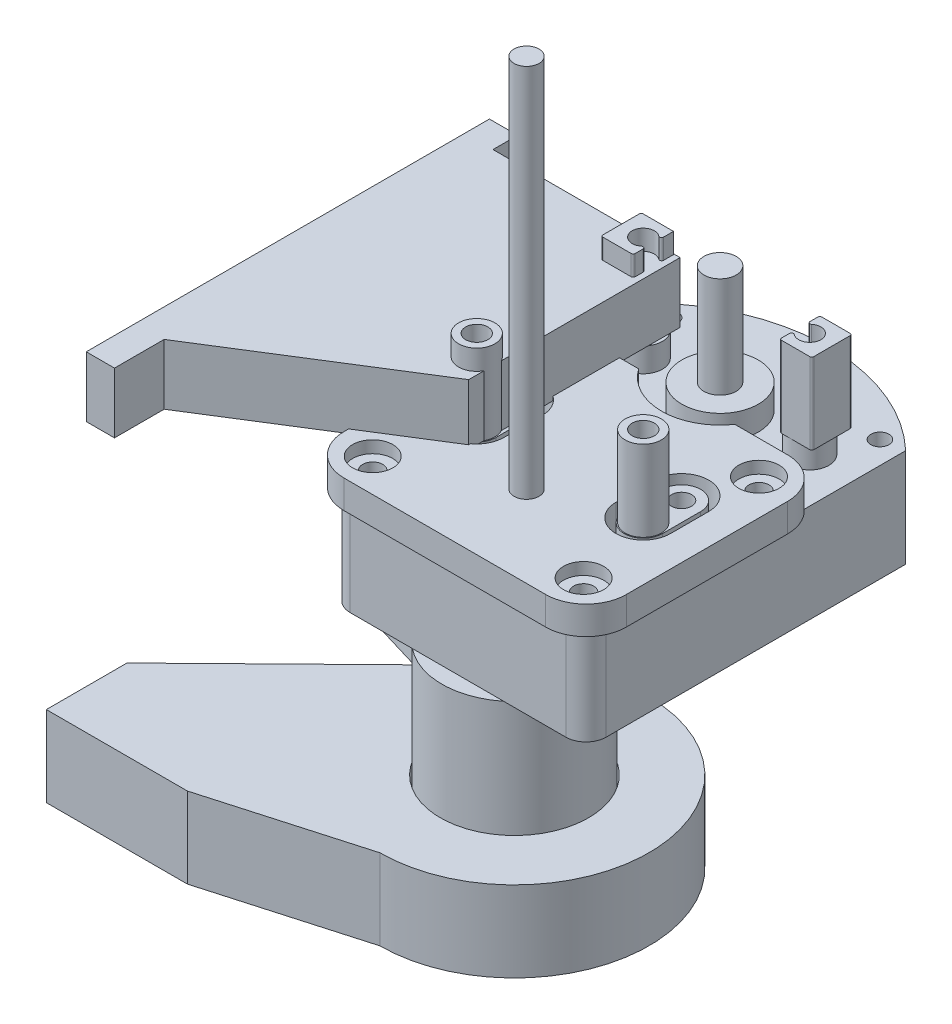
from build123d import *

# Parameters (mm, degrees)
SKETCH1_W              = 63.5
SKETCH1_H              = 92
SKETCH1_R              = 2.25
BOSS_EXTRUDE1_DEPTH    = 24.4
SKETCH2_R              = 4.75
SKETCH2_R_2            = 2.5
SKETCH2_R_3            = 9.5
SKETCH2_R_4            = 4
BOSS_EXTRUDE2_DEPTH    = 6
SKETCH3_R              = 4
BOSS_EXTRUDE3_DEPTH    = 31
FILLET1_R              = 5
SKETCH5_R              = 3.1
BOSS_EXTRUDE4_DEPTH    = 100
SKETCH6_R              = 18
BOSS_EXTRUDE5_DEPTH    = 57
CUT_EXTRUDE1_DEPTH     = 24.4
BOSS_EXTRUDE6_DEPTH    = 15
SKETCH9_R              = 18.4
BOSS_EXTRUDE7_DEPTH    = 20
SKETCH11_R             = 4.85
SKETCH11_R_2           = 2.25
BOSS_EXTRUDE8_DEPTH    = 1
SKETCH10_R             = 8.5
SKETCH10_R_2           = 5.85
BOSS_EXTRUDE9_DEPTH    = 7
SKETCH12_R             = 8.5
SKETCH12_R_2           = 3.1
BOSS_EXTRUDE10_DEPTH   = 1
FILLET2_R              = 10
SKETCH13_R             = 5.85
SKETCH13_R_2           = 2.5
BOSS_EXTRUDE11_DEPTH   = 6
SKETCH14_R             = 4.5
SKETCH14_R_2           = 2.75
BOSS_EXTRUDE12_DEPTH   = 20
BOSS_EXTRUDE12_2_DEPTH = 20
BOSS_EXTRUDE13_DEPTH   = 20
BOSS_EXTRUDE13_2_DEPTH = 20
FILLET3_R              = 0.5
FILLET4_R              = 0.5
SKETCH16_R             = 5
CUT_EXTRUDE2_DEPTH     = 3
SKETCH17_R             = 2.25
BOSS_EXTRUDE14_DEPTH   = 8
BOSS_EXTRUDE15_DEPTH   = 15
SKETCH19_R             = 2.75
CUT_EXTRUDE3_DEPTH     = 6
SKETCH20_R             = 2.75
CUT_EXTRUDE4_DEPTH     = 6
FILLET5_R              = 3
FILLET6_R              = 3


with BuildPart() as part:
    # Sketch1 → Boss-Extrude1 (new body)
    with BuildSketch(Plane(origin=(0, 0, 0), x_dir=(1, 0, 0), z_dir=(0, 1, 0))):
        Rectangle(SKETCH1_W, SKETCH1_H)
        with Locations(Location((26.15, 2.5, 0), (0, 0, 270))):
            Circle(SKETCH1_R, mode=Mode.SUBTRACT)
        with Locations(Location((-26.15, -41, 0), (0, 0, 270))):
            Circle(SKETCH1_R, mode=Mode.SUBTRACT)
        with Locations(Location((-26.15, 2.5, 0), (0, 0, 270))):
            Circle(SKETCH1_R, mode=Mode.SUBTRACT)
        with Locations(Location((-26.15, 32.5, 0), (0, 0, 270))):
            Circle(SKETCH1_R, mode=Mode.SUBTRACT)
        with Locations(Location((26.15, 32.5, 0), (0, 0, 270))):
            Circle(SKETCH1_R, mode=Mode.SUBTRACT)
        with Locations(Location((26.15, -41, 0), (0, 0, 270))):
            Circle(SKETCH1_R, mode=Mode.SUBTRACT)
    extrude(amount=BOSS_EXTRUDE1_DEPTH)

    # Sketch2 → Boss-Extrude2 (add)
    # profile 1 of 5: a face of its own
    with BuildSketch(Plane(origin=(0, 24.4, 0), x_dir=(1, 0, 0), z_dir=(0, 1, 0))):
        with Locations(Location((-20.65, 20.6, 0), (0, 0, 270))):
            Circle(SKETCH2_R)
        with Locations(Location((-20.65, 20.6, 0), (0, 0, 270))):
            Circle(SKETCH2_R_2, mode=Mode.SUBTRACT)
    # profile 2 of 5: a face of its own
    with BuildSketch(Plane(origin=(0, 24.4, 0), x_dir=(1, 0, 0), z_dir=(0, 1, 0))):
        with Locations(Location((0, 19, 0), (0, 0, 270))):
            Circle(SKETCH2_R_3)
        with Locations(Location((0, 19, 0), (0, 0, 270))):
            Circle(SKETCH2_R_4, mode=Mode.SUBTRACT)
    # profile 3 of 5: a face of its own
    with BuildSketch(Plane(origin=(0, 24.4, 0), x_dir=(1, 0, 0), z_dir=(0, 1, 0))):
        with Locations(Location((20.65, 20.6, 0), (0, 0, 90))):
            Circle(SKETCH2_R)
        with Locations(Location((20.65, 20.6, 0), (0, 0, 90))):
            Circle(SKETCH2_R_2, mode=Mode.SUBTRACT)
    # profile 4 of 5: a face of its own
    with BuildSketch(Plane(origin=(0, 24.4, 0), x_dir=(1, 0, 0), z_dir=(0, 1, 0))):
        with BuildLine():
            Line((-15.9, -11.2), (-15.9, -20.7))
            ThreePointArc((-15.9, -20.7), (-20.65, -25.45), (-25.4, -20.7))
            Line((-25.4, -20.7), (-25.4, -11.2))
            ThreePointArc((-25.4, -11.2), (-20.65, -6.45), (-15.9, -11.2))
        make_face()
        with Locations(Location((-20.65, -11.2, 0), (0, 0, 270))):
            Circle(SKETCH2_R_2, mode=Mode.SUBTRACT)
        with Locations(Location((-20.65, -20.7, 0), (0, 0, 270))):
            Circle(SKETCH2_R_2, mode=Mode.SUBTRACT)
    # profile 5 of 5: a face of its own
    with BuildSketch(Plane(origin=(0, 24.4, 0), x_dir=(1, 0, 0), z_dir=(0, 1, 0))):
        with BuildLine():
            Line((15.9, -11.2), (15.9, -20.7))
            ThreePointArc((15.9, -20.7), (20.65, -25.45), (25.4, -20.7))
            Line((25.4, -20.7), (25.4, -11.2))
            ThreePointArc((25.4, -11.2), (20.65, -6.45), (15.9, -11.2))
        make_face()
        with Locations(Location((20.65, -20.7, 0), (0, 0, 90))):
            Circle(SKETCH2_R_2, mode=Mode.SUBTRACT)
        with Locations(Location((20.65, -11.2, 0), (0, 0, 90))):
            Circle(SKETCH2_R_2, mode=Mode.SUBTRACT)
    extrude(amount=BOSS_EXTRUDE2_DEPTH)

    # Sketch3 → Boss-Extrude3 (add)
    with BuildSketch(Plane(origin=(0, 24.4, 0), x_dir=(1, 0, 0), z_dir=(0, 1, 0))):
        with Locations(Location((0, 19, 0), (0, 0, 270))):
            Circle(SKETCH3_R)
    extrude(amount=BOSS_EXTRUDE3_DEPTH)

    # Fillet1
    fillet1_edges = [part.edges().sort_by_distance(p)[0] for p in [
        (31.75, 12.2, 46),
        (-31.75, 12.2, 46),
    ]]
    fillet(fillet1_edges, radius=FILLET1_R)

    # Sketch6 → Boss-Extrude5 (add)
    with BuildSketch(Plane.XZ):
        with Locations(Location((0, 32, 0), (0, 0, 128.942441269))):
            Circle(SKETCH6_R)
    extrude(amount=BOSS_EXTRUDE5_DEPTH)

    # Sketch7 → Cut-Extrude1 (cut)
    with BuildSketch(Plane(origin=(0, 24.4, 0), x_dir=(1, 0, 0), z_dir=(0, 1, 0))):
        with BuildLine():
            ThreePointArc((-31.75, 33.285695126), (-17.100555901, 42.70329013), (0, 46))
            Line((0, 46), (-31.75, 46))
            Line((-31.75, 46), (-31.75, 33.285695126))
        make_face()
        with BuildLine():
            ThreePointArc((0, 46), (17.100555901, 42.70329013), (31.75, 33.285695126))
            Line((31.75, 33.285695126), (31.75, 46))
            Line((31.75, 46), (0, 46))
        make_face()
    extrude(amount=-CUT_EXTRUDE1_DEPTH, mode=Mode.SUBTRACT)

    # Sketch11 → Boss-Extrude8 (add)
    # profile 1 of 4: a face of its own
    with BuildSketch(Plane(origin=(0, 24.4, 0), x_dir=(1, 0, 0), z_dir=(0, 1, 0))):
        with Locations(Location((-26.15, 2.5, 0), (0, 0, 270))):
            Circle(SKETCH11_R)
        with Locations(Location((-26.15, 2.5, 0), (0, 0, 270))):
            Circle(SKETCH11_R_2, mode=Mode.SUBTRACT)
    # profile 2 of 4: a face of its own
    with BuildSketch(Plane(origin=(0, 24.4, 0), x_dir=(1, 0, 0), z_dir=(0, 1, 0))):
        with Locations(Location((26.15, 2.5, 0), (0, 0, 270))):
            Circle(SKETCH11_R)
        with Locations(Location((26.15, 2.5, 0), (0, 0, 270))):
            Circle(SKETCH11_R_2, mode=Mode.SUBTRACT)
    # profile 3 of 4: a face of its own
    with BuildSketch(Plane(origin=(0, 24.4, 0), x_dir=(1, 0, 0), z_dir=(0, 1, 0))):
        with Locations(Location((-26.15, -41, 0), (0, 0, 270))):
            Circle(SKETCH11_R)
        with Locations(Location((-26.15, -41, 0), (0, 0, 270))):
            Circle(SKETCH11_R_2, mode=Mode.SUBTRACT)
    # profile 4 of 4: a face of its own
    with BuildSketch(Plane(origin=(0, 24.4, 0), x_dir=(1, 0, 0), z_dir=(0, 1, 0))):
        with Locations(Location((26.15, -41, 0), (0, 0, 270))):
            Circle(SKETCH11_R)
        with Locations(Location((26.15, -41, 0), (0, 0, 270))):
            Circle(SKETCH11_R_2, mode=Mode.SUBTRACT)
    extrude(amount=BOSS_EXTRUDE8_DEPTH)


with BuildPart() as body_2:
    # Sketch5 → Boss-Extrude4 (new body)
    with BuildSketch(Plane(origin=(0, 24.4, 0), x_dir=(1, 0, 0), z_dir=(0, 1, 0))):
        with Locations(Location((0, -29, 0), (0, 0, 270))):
            Circle(SKETCH5_R)
    extrude(amount=BOSS_EXTRUDE4_DEPTH)


with BuildPart() as body_3:
    # Sketch8 → Boss-Extrude6 (new body)
    with BuildSketch(Plane(origin=(0, 30.4, 0), x_dir=(1, 0, 0), z_dir=(0, 1, 0))):
        Polygon((-16.699127066, 25.789474079), (-16.699127066, -26.645742509), (-63.11, -55.775738239), (-63.11, -68.098641121), (-70.11, -68.098641121), (-70.11, 31.901358879), (-63.11, 31.901358879), (-63.11, 25.789474079), align=None)
    extrude(amount=BOSS_EXTRUDE6_DEPTH)


with BuildPart() as body_4:
    # Sketch9 → Boss-Extrude7 (new body)
    with BuildSketch(Plane(origin=(0, -28.5, 0), x_dir=(-1, 0, 0), z_dir=(0, -1, 0))):
        with BuildLine():
            Line((25.14916505, -10.058638045), (72.11, -56))
            Line((72.11, -56), (72.11, -76))
            Line((72.11, -76), (37.11, -76))
            Line((37.11, -76), (0, -65.4))
            ThreePointArc((0, -65.4), (-33.4, -32), (0, 1.4))
            Line((0, 1.4), (42.281592381, 24))
            Line((42.281592381, 24), (72.11, 24))
            Line((72.11, 24), (72.11, 4))
            Line((72.11, 4), (25.14916505, -10.058638045))
        make_face()
        with Locations(Location((0, -32, 0), (0, 0, 90))):
            Circle(SKETCH9_R, mode=Mode.SUBTRACT)
    extrude(amount=BOSS_EXTRUDE7_DEPTH)


with BuildPart() as body_5:
    # Sketch10 → Boss-Extrude9 (new body)
    with BuildSketch(Plane(origin=(0, 24.4, 0), x_dir=(1, 0, 0), z_dir=(0, 1, 0))):
        with BuildLine():
            Line((-11.924240018, 10.75), (-35, 10.75))
            Line((-35, 10.75), (-35, -49.25))
            Line((-35, -49.25), (35, -49.25))
            Line((35, -49.25), (35, 10.75))
            Line((35, 10.75), (11.924240018, 10.75))
            ThreePointArc((11.924240018, 10.75), (0, 4.5), (-11.924240018, 10.75))
        make_face()
        with Locations(Location((0, -29, 0), (0, 0, 270))):
            Circle(SKETCH10_R, mode=Mode.SUBTRACT)
        with Locations(Location((-26.15, 2.5, 0), (0, 0, 270))):
            Circle(SKETCH10_R_2, mode=Mode.SUBTRACT)
        with Locations(Location((26.15, 2.5, 0), (0, 0, 270))):
            Circle(SKETCH10_R_2, mode=Mode.SUBTRACT)
        with Locations(Location((26.15, -41, 0), (0, 0, 270))):
            Circle(SKETCH10_R_2, mode=Mode.SUBTRACT)
        with Locations(Location((-26.15, -41, 0), (0, 0, 270))):
            Circle(SKETCH10_R_2, mode=Mode.SUBTRACT)
        with BuildLine():
            Line((13.9, -11.2), (13.9, -20.7))
            ThreePointArc((13.9, -20.7), (20.65, -27.45), (27.4, -20.7))
            Line((27.4, -20.7), (27.4, -11.2))
            ThreePointArc((27.4, -11.2), (20.65, -4.45), (13.9, -11.2))
        make_face(mode=Mode.SUBTRACT)
        with BuildLine():
            Line((-27.4, -11.2), (-27.4, -20.7))
            ThreePointArc((-27.4, -20.7), (-20.65, -27.45), (-13.9, -20.7))
            Line((-13.9, -20.7), (-13.9, -11.2))
            ThreePointArc((-13.9, -11.2), (-20.65, -4.45), (-27.4, -11.2))
        make_face(mode=Mode.SUBTRACT)
    extrude(amount=BOSS_EXTRUDE9_DEPTH)

    # Sketch12 → Boss-Extrude10 (add)
    with BuildSketch(Plane(origin=(0, 31.4, 0), x_dir=(1, 0, 0), z_dir=(0, 1, 0))):
        with Locations(Location((0, -29, 0), (0, 0, 270))):
            Circle(SKETCH12_R)
        with Locations(Location((0, -29, 0), (0, 0, 270))):
            Circle(SKETCH12_R_2, mode=Mode.SUBTRACT)
    extrude(amount=-BOSS_EXTRUDE10_DEPTH)

    # Fillet2
    fillet2_edges = [body_5.edges().sort_by_distance(p)[0] for p in [
        (35, 27.9, -10.75),
        (35, 27.9, 49.25),
        (-35, 27.9, 49.25),
        (-35, 27.9, -10.75),
    ]]
    fillet(fillet2_edges, radius=FILLET2_R)

    # Sketch13 → Boss-Extrude11 (add)
    # profile 1 of 4: a face of its own
    with BuildSketch(Plane(origin=(0, 31.4, 0), x_dir=(1, 0, 0), z_dir=(0, 1, 0))):
        with Locations(Location((-26.15, 2.5, 0), (0, 0, 270))):
            Circle(SKETCH13_R)
        with Locations(Location((-26.15, 2.5, 0), (0, 0, 270))):
            Circle(SKETCH13_R_2, mode=Mode.SUBTRACT)
    # profile 2 of 4: a face of its own
    with BuildSketch(Plane(origin=(0, 31.4, 0), x_dir=(1, 0, 0), z_dir=(0, 1, 0))):
        with Locations(Location((26.15, 2.5, 0), (0, 0, 270))):
            Circle(SKETCH13_R)
        with Locations(Location((26.15, 2.5, 0), (0, 0, 270))):
            Circle(SKETCH13_R_2, mode=Mode.SUBTRACT)
    # profile 3 of 4: a face of its own
    with BuildSketch(Plane(origin=(0, 31.4, 0), x_dir=(1, 0, 0), z_dir=(0, 1, 0))):
        with Locations(Location((-26.15, -41, 0), (0, 0, 270))):
            Circle(SKETCH13_R)
        with Locations(Location((-26.15, -41, 0), (0, 0, 270))):
            Circle(SKETCH13_R_2, mode=Mode.SUBTRACT)
    # profile 4 of 4: a face of its own
    with BuildSketch(Plane(origin=(0, 31.4, 0), x_dir=(1, 0, 0), z_dir=(0, 1, 0))):
        with Locations(Location((26.15, -41, 0), (0, 0, 270))):
            Circle(SKETCH13_R)
        with Locations(Location((26.15, -41, 0), (0, 0, 270))):
            Circle(SKETCH13_R_2, mode=Mode.SUBTRACT)
    extrude(amount=-BOSS_EXTRUDE11_DEPTH)

    # Sketch16 → Cut-Extrude2 (cut)
    with BuildSketch(Plane(origin=(0, 31.4, 0), x_dir=(1, 0, 0), z_dir=(0, 1, 0))):
        with Locations(Location((-26.15, 2.5, 0), (0, 0, 270))):
            Circle(SKETCH16_R)
        with Locations(Location((26.15, 2.5, 0), (0, 0, 270))):
            Circle(SKETCH16_R)
        with Locations(Location((26.15, -41, 0), (0, 0, 270))):
            Circle(SKETCH16_R)
        with Locations(Location((-26.15, -41, 0), (0, 0, 270))):
            Circle(SKETCH16_R)
    extrude(amount=-CUT_EXTRUDE2_DEPTH, mode=Mode.SUBTRACT)


with BuildPart() as body_6:
    # Sketch14 → Boss-Extrude12 (new body)
    with BuildSketch(Plane(origin=(0, 30.4, 0), x_dir=(1, 0, 0), z_dir=(0, 1, 0))):
        with Locations(Location((20.65, -20.7, 0), (0, 0, 270))):
            Circle(SKETCH14_R)
        with Locations(Location((20.65, -20.7, 0), (0, 0, 270))):
            Circle(SKETCH14_R_2, mode=Mode.SUBTRACT)
    extrude(amount=BOSS_EXTRUDE12_DEPTH)


with BuildPart() as body_7:
    # Sketch14 → Boss-Extrude12 2 (new body)
    with BuildSketch(Plane(origin=(0, 30.4, 0), x_dir=(1, 0, 0), z_dir=(0, 1, 0))):
        with Locations(Location((-20.65, -20.7, 0), (0, 0, 270))):
            Circle(SKETCH14_R)
        with Locations(Location((-20.65, -20.7, 0), (0, 0, 270))):
            Circle(SKETCH14_R_2, mode=Mode.SUBTRACT)
    extrude(amount=BOSS_EXTRUDE12_2_DEPTH)


with BuildPart() as body_8:
    # Sketch15 → Boss-Extrude13 (new body)
    with BuildSketch(Plane(origin=(0, 30.4, 0), x_dir=(1, 0, 0), z_dir=(0, 1, 0))):
        with BuildLine():
            Line((-18.15, 24.638873605), (-18.15, 21.745643924))
            ThreePointArc((-18.15, 21.745643924), (-23.4, 20.6), (-18.15, 19.454356076))
            Line((-18.15, 19.454356076), (-18.15, 16.561126395))
            Line((-18.15, 16.561126395), (-18.15, 15.6))
            Line((-18.15, 15.6), (-26.15, 15.6))
            Line((-26.15, 15.6), (-26.15, 25.6))
            Line((-26.15, 25.6), (-18.15, 25.6))
            Line((-18.15, 25.6), (-18.15, 24.638873605))
        make_face()
    extrude(amount=BOSS_EXTRUDE13_DEPTH)

    # Fillet3
    fillet3_edges = [body_8.edges().sort_by_distance(p)[0] for p in [
        (-18.15, 40.4, -19.454356076),
        (-18.15, 40.4, -15.6),
        (-26.15, 40.4, -15.6),
        (-26.15, 40.4, -25.6),
        (-18.15, 40.4, -21.745643924),
    ]]
    fillet(fillet3_edges, radius=FILLET3_R)


with BuildPart() as body_9:
    # Sketch15 → Boss-Extrude13 2 (new body)
    with BuildSketch(Plane(origin=(0, 30.4, 0), x_dir=(1, 0, 0), z_dir=(0, 1, 0))):
        with BuildLine():
            Line((18.15, 15.6), (18.15, 16.561126395))
            Line((18.15, 16.561126395), (18.15, 19.454356076))
            ThreePointArc((18.15, 19.454356076), (23.4, 20.6), (18.15, 21.745643924))
            Line((18.15, 21.745643924), (18.15, 24.638873605))
            Line((18.15, 24.638873605), (18.15, 25.6))
            Line((18.15, 25.6), (26.15, 25.6))
            Line((26.15, 25.6), (26.15, 15.6))
            Line((26.15, 15.6), (18.15, 15.6))
        make_face()
    extrude(amount=BOSS_EXTRUDE13_2_DEPTH)

    # Fillet4
    fillet4_edges = [body_9.edges().sort_by_distance(p)[0] for p in [
        (18.15, 40.4, -21.745643924),
        (18.15, 40.4, -25.6),
        (26.15, 40.4, -25.6),
        (26.15, 40.4, -15.6),
        (18.15, 40.4, -15.6),
        (18.15, 40.4, -19.454356076),
    ]]
    fillet(fillet4_edges, radius=FILLET4_R)


with BuildPart() as body_10:
    # Sketch17 → Boss-Extrude14 (new body)
    with BuildSketch(Plane.XZ):
        Polygon((-21.15, 5), (-49.84, 5), (-69.84, -4), (-69.84, -21), (-86.84, -21), (-86.84, -27), (-73.84, -40), (-21.15, -40), align=None)
        with Locations(Location((-26.15, -32.5, 0), (0, 0, 270))):
            Circle(SKETCH17_R, mode=Mode.SUBTRACT)
        with Locations(Location((-26.15, -2.5, 0), (0, 0, 270))):
            Circle(SKETCH17_R, mode=Mode.SUBTRACT)
    extrude(amount=BOSS_EXTRUDE14_DEPTH)

    # Sketch18 → Boss-Extrude15 (add)
    with BuildSketch(Plane.XZ.offset(8)):
        Polygon((-63.84, -1.3), (-63.84, -27), (-86.84, -27), (-86.84, -21), (-69.84, -21), (-69.84, -4), align=None)
    extrude(amount=BOSS_EXTRUDE15_DEPTH)

    # Sketch19 → Cut-Extrude3 (cut)
    with BuildSketch(Plane.XY.offset(-21)):
        with Locations((-78.34, -17)):
            Circle(SKETCH19_R)
    extrude(amount=-CUT_EXTRUDE3_DEPTH, mode=Mode.SUBTRACT)

    # Sketch20 → Cut-Extrude4 (cut)
    with BuildSketch(Plane.ZY.offset(69.84)):
        with Locations((-12.5, -17)):
            Circle(SKETCH20_R)
    extrude(amount=-CUT_EXTRUDE4_DEPTH, mode=Mode.SUBTRACT)

    # Fillet5
    fillet5_edges = [body_10.edges().sort_by_distance(p)[0] for p in [
        (-75.34, -8, -27),
        (-63.84, -8, -14.15),
    ]]
    fillet(fillet5_edges, radius=FILLET5_R)

    # Fillet6
    fillet6_edges = [body_10.edges().sort_by_distance(p)[0] for p in [
        (-21.15, -4, 5),
        (-21.15, -4, -40),
        (-86.84, -11.5, -21),
        (-69.84, -11.5, -4),
    ]]
    fillet(fillet6_edges, radius=FILLET6_R)


solid = Compound([part.part, body_2.part, body_3.part, body_4.part, body_5.part, body_6.part, body_7.part, body_8.part, body_9.part, body_10.part])
